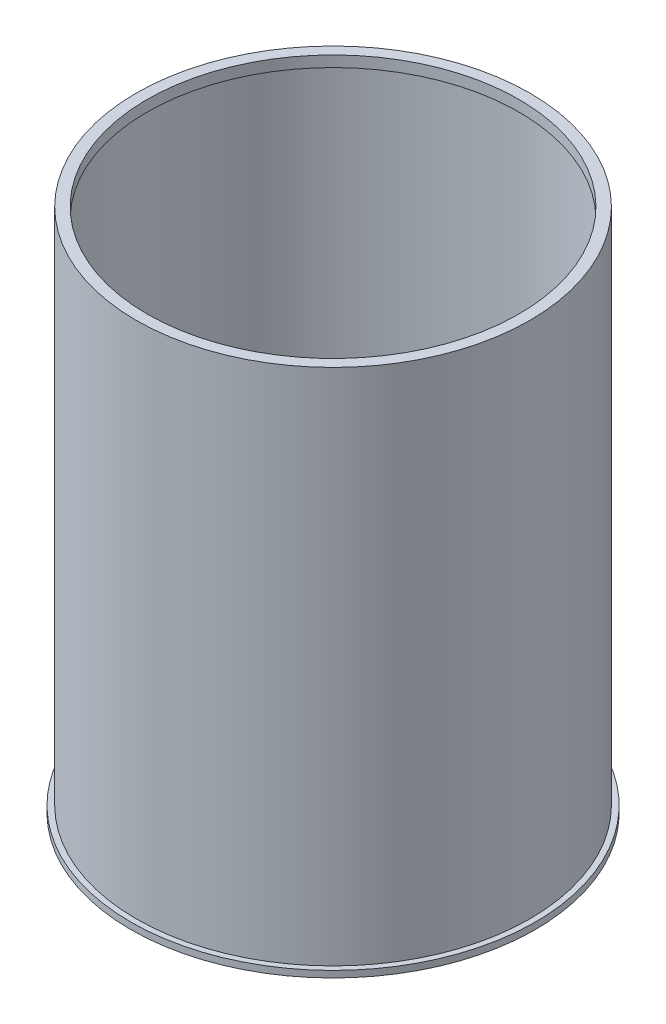
from build123d import *

# Parameters (mm, degrees)
RECEPTACLE_FLOOR_SKETCH_R   = 185
RECEPTACLE_FLOOR_SKETCH_R_2 = 12.5
RECEPTACLE_FLOOR_DEPTH      = 6
RECEPTACLE_WALL_SKETCH_R    = 180
RECEPTACLE_WALL_SKETCH_R_2  = 176
RECEPTACLE_WALL_DEPTH       = 480
POT_START                   = 470
POT_SEAT_LEDGE_SKETCH_R     = 177
POT_SEAT_LEDGE_SKETCH_R_2   = 170
POT_SEAT_LEDGE_DEPTH        = 10


with BuildPart() as part:
    # Receptacle Floor Sketch → Receptacle Floor (new body)
    with BuildSketch(Plane(origin=(0, 0, 0), x_dir=(1, 0, 0), z_dir=(0, 1, 0))):
        with Locations(Location((0, 0, 0), (0, 0, 270))):
            Circle(RECEPTACLE_FLOOR_SKETCH_R)
        with Locations(Location((0, 0, 0), (0, 0, 270))):
            Circle(RECEPTACLE_FLOOR_SKETCH_R_2, mode=Mode.SUBTRACT)
    extrude(amount=RECEPTACLE_FLOOR_DEPTH)

    # Receptacle Wall Sketch → Receptacle Wall (add)
    with BuildSketch(Plane(origin=(0, 0, 0), x_dir=(1, 0, 0), z_dir=(0, 1, 0))):
        with Locations(Location((0, 0, 0), (0, 0, 270))):
            Circle(RECEPTACLE_WALL_SKETCH_R)
        with Locations(Location((0, 0, 0), (0, 0, 270))):
            Circle(RECEPTACLE_WALL_SKETCH_R_2, mode=Mode.SUBTRACT)
    extrude(amount=RECEPTACLE_WALL_DEPTH)

    # Pot Seat Ledge Sketch → Pot Seat Ledge (add)
    with BuildSketch(Plane(origin=(0, 0, 0), x_dir=(1, 0, 0), z_dir=(0, 1, 0)).offset(POT_START)):
        Circle(POT_SEAT_LEDGE_SKETCH_R)
        with Locations(Location((0, 0, 0), (0, 0, 270))):
            Circle(POT_SEAT_LEDGE_SKETCH_R_2, mode=Mode.SUBTRACT)
    extrude(amount=POT_SEAT_LEDGE_DEPTH)


solid = part.part
